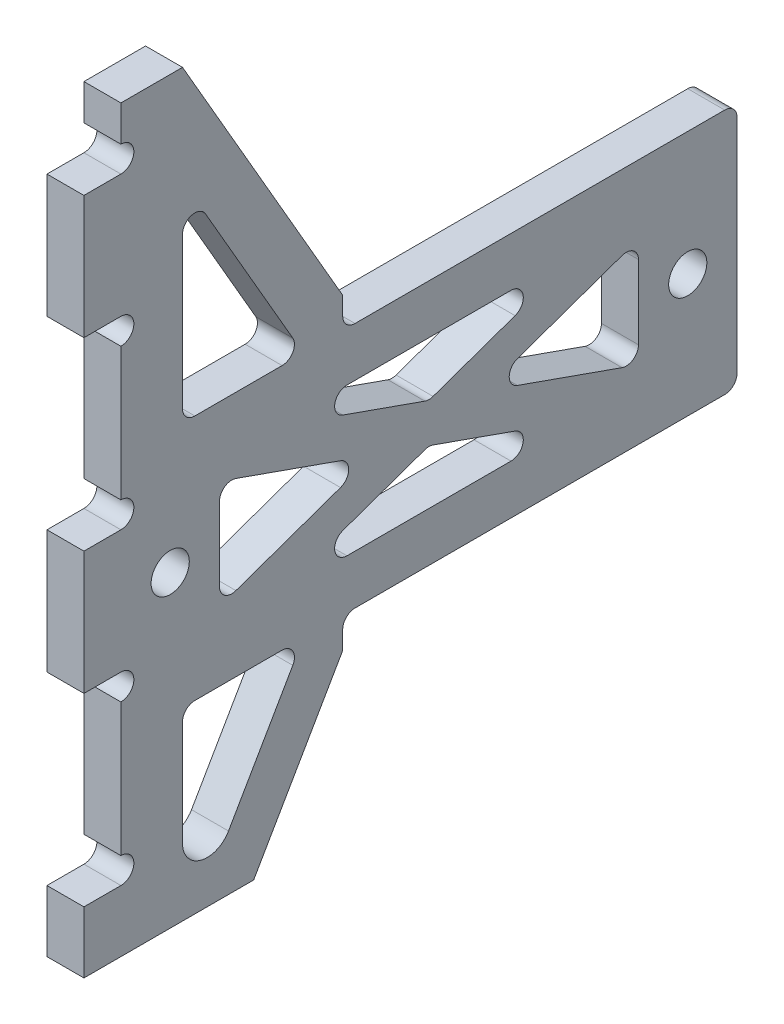
from build123d import *
from OCP.BRepFilletAPI import BRepFilletAPI_MakeFillet

# Parameters (mm, degrees)
SKETCH_1_R          = 1.55
EXTRUDE_1_DEPTH     = 3
FILLET_1_R1         = 1
FILLET_1_R2         = 2
SKETCH_2_W          = 23.55236831
SKETCH_2_H          = 10
CUT_EXTRUDE_1_DEPTH = 10


with BuildPart() as part:
    # 草图1 → 凸台-拉伸1 (new body)
    with BuildSketch(Plane(origin=(0, 0, 0), x_dir=(0, 0, -1), z_dir=(1, 0, 0))):
        with BuildLine():
            Line((-7, -10), (25, -10))
            Line((25, -10), (25, 10))
            Line((25, 10), (-7, 10))
            Line((-7, 10), (-7, 12.483339502))
            Line((-7, 12.483339502), (-20, 35))
            Line((-20, 35), (-25, 35))
            Line((-25, 35), (-25, 32.1))
            ThreePointArc((-25, 32.1), (-24.25753788, 31.79246212), (-23.95, 31.05))
            ThreePointArc((-23.95, 31.05), (-24.25753788, 30.30753788), (-25, 30))
            Line((-25, 30), (-28, 30))
            Line((-28, 30), (-28, 20))
            Line((-28, 20), (-25, 20))
            ThreePointArc((-25, 20), (-24.25753788, 19.69246212), (-23.95, 18.95))
            ThreePointArc((-23.95, 18.95), (-24.25753788, 18.20753788), (-25, 17.9))
            Line((-25, 17.9), (-25, 10))
            Line((-25, 10), (-25, 7.1))
            ThreePointArc((-25, 7.1), (-24.25753788, 6.79246212), (-23.95, 6.05))
            ThreePointArc((-23.95, 6.05), (-24.25753788, 5.30753788), (-25, 5))
            Line((-25, 5), (-28, 5))
            Line((-28, 5), (-28, -5))
            Line((-28, -5), (-25, -5))
            ThreePointArc((-25, -5), (-24.25753788, -5.30753788), (-23.95, -6.05))
            ThreePointArc((-23.95, -6.05), (-24.25753788, -6.79246212), (-25, -7.1))
            Line((-25, -7.1), (-25, -10))
            Line((-25, -10), (-25, -17.9))
            ThreePointArc((-25, -17.9), (-24.25753788, -18.20753788), (-23.95, -18.95))
            ThreePointArc((-23.95, -18.95), (-24.25753788, -19.69246212), (-25, -20))
            Line((-25, -20), (-28, -20))
            Line((-28, -20), (-28, -30))
            Line((-28, -30), (-25, -30))
            ThreePointArc((-25, -30), (-24.25753788, -30.30753788), (-23.95, -31.05))
            ThreePointArc((-23.95, -31.05), (-24.25753788, -31.79246212), (-25, -32.1))
            Line((-25, -32.1), (-25, -35))
            Line((-25, -35), (-20, -35))
            Line((-20, -35), (-7, -12.483339502))
            Line((-7, -12.483339502), (-7, -10))
        make_face()
        Polygon((-10.185045424, -10), (-20, -27), (-20, -10), align=None, mode=Mode.SUBTRACT)
        Polygon((12.493060906, -6), (-12.493060906, -6), (0, -1.590684386), align=None, mode=Mode.SUBTRACT)
        with Locations((-21, 0)):
            Circle(SKETCH_1_R, mode=Mode.SUBTRACT)
        Polygon((-4.506939094, 0), (-17, -4.409315614), (-17, 4.409315614), align=None, mode=Mode.SUBTRACT)
        Polygon((-10.185045424, 10), (-20, 10), (-20, 27), align=None, mode=Mode.SUBTRACT)
        Polygon((0, 1.590684386), (-12.493060906, 6), (12.493060906, 6), align=None, mode=Mode.SUBTRACT)
        Polygon((17, 4.409315614), (17, -4.409315614), (4.506939094, 0), align=None, mode=Mode.SUBTRACT)
        with Locations((21, 0)):
            Circle(SKETCH_1_R, mode=Mode.SUBTRACT)
    extrude(amount=EXTRUDE_1_DEPTH)

    # 圆角1: one fillet with a radius per group of edges: ONE call of the kernel's fillet builder (fillet() takes one radius for all edges)
    fillet_1_edges_1 = [part.edges().sort_by_distance(p)[0] for p in [
        (1.5, -10, 10.185045424),
        (1.5, -10, 20),
        (1.5, 10, 10.185045424),
        (1.5, 10, 20),
        (1.5, 27, 20),
        (1.5, 10, 7),
        (1.5, 10, -25),
        (1.5, -10, -25),
        (1.5, -10, 7),
        (1.5, -4.409315614, 17),
        (1.5, 1.590684386, 0),
        (1.5, 6, 12.493060906),
        (1.5, 6, -12.493060906),
        (1.5, 4.409315614, 17),
        (1.5, 0, 4.506939094),
        (1.5, 0, -4.506939094),
        (1.5, 4.409315614, -17),
        (1.5, -4.409315614, -17),
        (1.5, -1.590684386, 0),
        (1.5, -6, -12.493060906),
        (1.5, -6, 12.493060906),
    ]]
    fillet_1_edges_2 = [part.edges().sort_by_distance(p)[0] for p in [
        (1.5, -27, 20),
    ]]
    fillet_1 = BRepFilletAPI_MakeFillet(part.part.solid().wrapped)
    for e in fillet_1_edges_1:
        fillet_1.Add(FILLET_1_R1, e.wrapped)
    for e in fillet_1_edges_2:
        fillet_1.Add(FILLET_1_R2, e.wrapped)
    add(Compound.cast(fillet_1.Shape()), mode=Mode.REPLACE)

    # 草图2 → 切除-拉伸1 (cut)
    with BuildSketch(Plane(origin=(3, 0, 0), x_dir=(0, 0, -1), z_dir=(1, 0, 0))):
        with Locations((-22.372535414, -30)):
            Rectangle(SKETCH_2_W, SKETCH_2_H)
    extrude(amount=-CUT_EXTRUDE_1_DEPTH, mode=Mode.SUBTRACT)


solid = part.part
